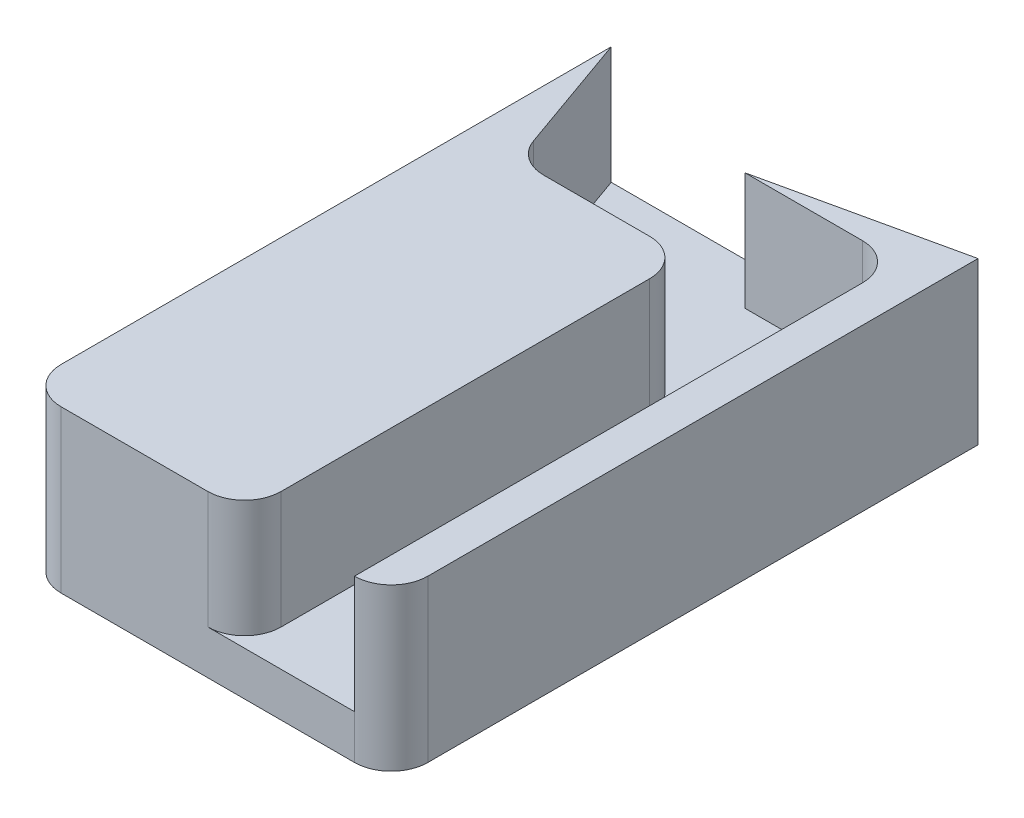
from build123d import *

# Parameters (mm, degrees)
SKETCH1_W           = 50
SKETCH1_H           = 80
BOSS_EXTRUDE1_DEPTH = 6
BOSS_EXTRUDE2_DEPTH = 16
FILLET1_R           = 5
FILLET2_R           = 5
SKETCH3_R           = 2.6
CUT_EXTRUDE1_DEPTH  = 10
SKETCH4_W           = 24
SKETCH4_H           = 47.75
CUT_EXTRUDE3_DEPTH  = 20
SKETCH5_W           = 23.965270804
SKETCH5_H           = 10
BOSS_EXTRUDE3_DEPTH = 16
FILLET3_R           = 5


with BuildPart() as part:
    # Sketch1 → Boss-Extrude1 (new body)
    with BuildSketch(Plane(origin=(0, 0, 0), x_dir=(1, 0, 0), z_dir=(0, 1, 0))):
        with Locations((-55.945507312, -78.533333333)):
            Rectangle(SKETCH1_W, SKETCH1_H)
    extrude(amount=BOSS_EXTRUDE1_DEPTH)

    # Sketch2 → Boss-Extrude2 (add)
    with BuildSketch(Plane(origin=(0, 6, 0), x_dir=(1, 0, 0), z_dir=(0, 1, 0))):
        Polygon((-80.945507312, -38.533333333), (-80.945507312, -118.533333333), (-50.945507312, -118.533333333), (-50.945507312, -58.292829883), (-73.945507312, -58.292829883), align=None)
        Polygon((-35.945507312, -44.292829883), (-35.945507312, -118.533333333), (-30.945507312, -118.533333333), (-30.945507312, -38.533333333), (-56.945507312, -44.292829883), align=None)
    extrude(amount=BOSS_EXTRUDE2_DEPTH)

    # Fillet1
    fillet1_edges = [part.edges().sort_by_distance(p)[0] for p in [
        (-50.945507312, 14, 58.292829883),
        (-73.945507312, 14, 58.292829883),
    ]]
    fillet(fillet1_edges, radius=FILLET1_R)

    # Fillet2
    fillet2_edges = [part.edges().sort_by_distance(p)[0] for p in [
        (-35.945507312, 14, 44.292829883),
    ]]
    fillet(fillet2_edges, radius=FILLET2_R)

    # Sketch3 → Cut-Extrude1 (cut)
    with BuildSketch(Plane(origin=(0, 0, 58.292829883), x_dir=(-1, 0, 0), z_dir=(0, 0, -1))):
        with Locations((59.128917582, 16.867919386)):
            Circle(SKETCH3_R)
        with Locations((67.228917582, 16.867919386)):
            Circle(SKETCH3_R)
    extrude(amount=-CUT_EXTRUDE1_DEPTH, mode=Mode.SUBTRACT)

    # Sketch4 → Cut-Extrude3 (cut)
    with BuildSketch(Plane.XZ):
        with Locations((-65.945507312, 92.158333333)):
            Rectangle(SKETCH4_W, SKETCH4_H)
    extrude(amount=-CUT_EXTRUDE3_DEPTH, mode=Mode.SUBTRACT)

    # Sketch5 → Boss-Extrude3 (add)
    with BuildSketch(Plane.XY.offset(68.283333333)):
        with Locations((-65.928142714, 5)):
            Rectangle(SKETCH5_W, SKETCH5_H)
    extrude(amount=BOSS_EXTRUDE3_DEPTH)

    # Fillet3
    fillet3_edges = [part.edges().sort_by_distance(p)[0] for p in [
        (-50.945507312, 14, 118.533333333),
        (-30.945507312, 11, 118.533333333),
        (-80.945507312, 11, 118.533333333),
    ]]
    fillet(fillet3_edges, radius=FILLET3_R)


solid = part.part
